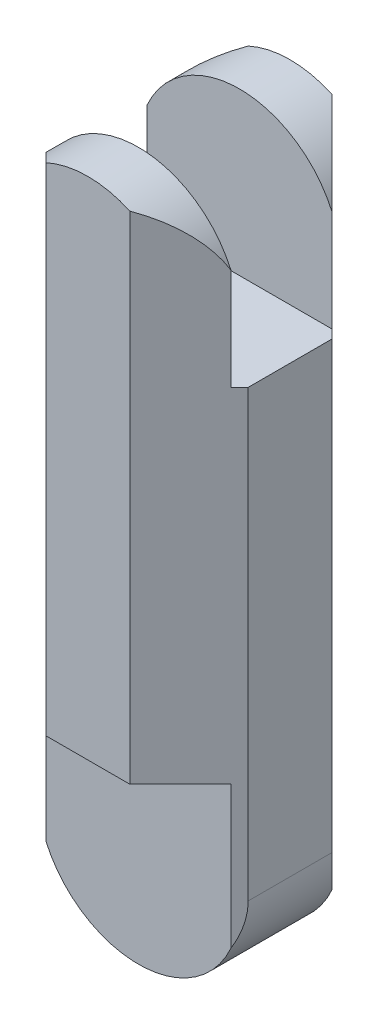
from build123d import *

# Parameters (mm, degrees)
EXTRUDE_1_DEPTH     = 74
CUT_EXTRUDE_1_DEPTH = 66
CUT_EXTRUDE_2_DEPTH = 5
CUT_EXTRUDE_START   = -5
CUT_EXTRUDE_3_DEPTH = 5
SKETCH_6_W          = 20
SKETCH_6_H          = 20
CUT_EXTRUDE_4_DEPTH = 5
CUT_EXTRUDE_5_DEPTH = 30


with BuildPart() as part:
    # 草图1 → 凸台-拉伸1 (new body)
    with BuildSketch(Plane(origin=(0, 0, 0), x_dir=(1, 0, 0), z_dir=(0, 1, 0))):
        Polygon((10, 4.142135624), (4.142135624, 10), (-4.142135624, 10), (-10, 4.142135624), (-10, -4.142135624), (-4.142135624, -10), (4.142135624, -10), (10, -4.142135624), align=None)
    extrude(amount=EXTRUDE_1_DEPTH)

    # 草图2 → 切除-拉伸1 (cut)
    with BuildSketch(Plane.XY.offset(10)):
        with BuildLine():
            Line((-10, 10), (-10, -2.389295552))
            Line((-10, -2.389295552), (10, -2.389295552))
            Line((10, -2.389295552), (10, 10))
            ThreePointArc((10, 10), (0, 0), (-10, 10))
        make_face()
    extrude(amount=-CUT_EXTRUDE_1_DEPTH, mode=Mode.SUBTRACT)

    # 草图4 → 切除-拉伸2 (cut)
    with BuildSketch(Plane.XY.offset(10)):
        with BuildLine():
            Line((-10, 10), (-10, 20))
            Line((-10, 20), (10, 20))
            Line((10, 20), (10, 10))
            ThreePointArc((10, 10), (0, 0), (-10, 10))
        make_face()
    extrude(amount=-CUT_EXTRUDE_2_DEPTH, mode=Mode.SUBTRACT)

    # 草图5 → 切除-拉伸3 (cut)
    with BuildSketch(Plane(origin=(0, 0, -10), x_dir=(-1, 0, 0), z_dir=(0, 0, -1)).offset(CUT_EXTRUDE_START)):
        with BuildLine():
            Line((-10, 10), (-10, 20))
            Line((-10, 20), (10, 20))
            Line((10, 20), (10, 10))
            ThreePointArc((10, 10), (0, 0), (-10, 10))
        make_face()
    extrude(amount=CUT_EXTRUDE_3_DEPTH, mode=Mode.SUBTRACT)

    # 草图6 → 切除-拉伸4 (cut, symmetric)
    with BuildSketch(Plane.XY):
        with Locations((0, 64)):
            Rectangle(SKETCH_6_W, SKETCH_6_H)
    extrude(amount=CUT_EXTRUDE_4_DEPTH, both=True, mode=Mode.SUBTRACT)

    # 草图7 → 切除-拉伸5 (cut)
    with BuildSketch(Plane.XY.offset(10)):
        with BuildLine():
            Line((-10, 60), (-10, 79.107913371))
            Line((-10, 79.107913371), (10, 79.107913371))
            Line((10, 79.107913371), (10, 60))
            ThreePointArc((10, 60), (0, 70), (-10, 60))
        make_face()
    extrude(amount=-CUT_EXTRUDE_5_DEPTH, mode=Mode.SUBTRACT)


solid = part.part
